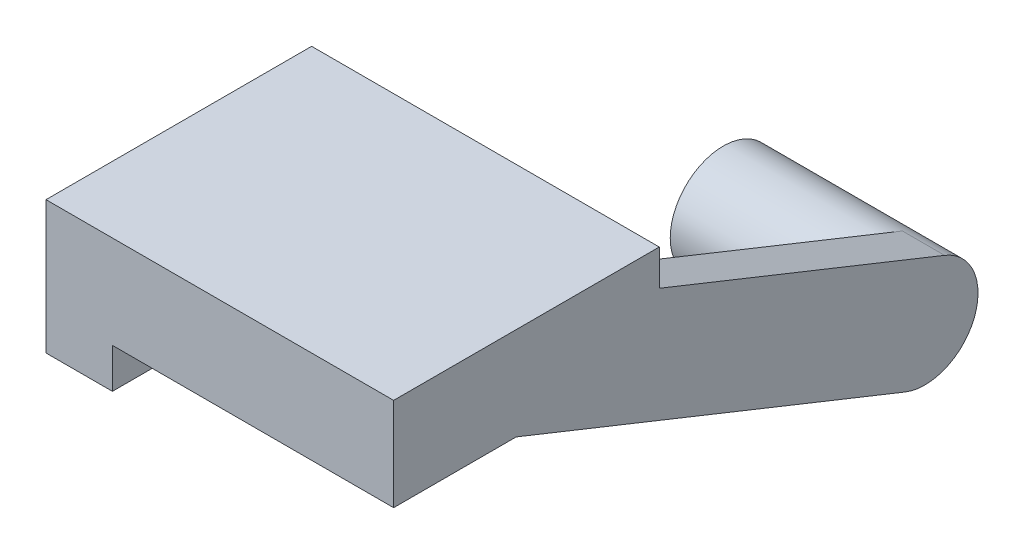
from build123d import *

# Parameters (mm, degrees)
SKETCH1_W           = 20
SKETCH1_H           = 10
SKETCH1_R           = 1.65
BOSS_EXTRUDE1_DEPTH = 5
SKETCH2_W           = 20
SKETCH2_H           = 7
BOSS_EXTRUDE2_DEPTH = 18
BOSS_EXTRUDE3_DEPTH = 3.175
BOSS_EXTRUDE4_START = 12
SKETCH4_R           = 4
BOSS_EXTRUDE4_DEPTH = 12


with BuildPart() as part:
    # Sketch1 → Boss-Extrude1 (new body)
    with BuildSketch(Plane(origin=(0, 0, 0), x_dir=(0, 0, -1), z_dir=(1, 0, 0))):
        Rectangle(SKETCH1_W, SKETCH1_H)
        with Locations((-5, 0)):
            Circle(SKETCH1_R, mode=Mode.SUBTRACT)
        with Locations((5, 0)):
            Circle(SKETCH1_R, mode=Mode.SUBTRACT)
    extrude(amount=BOSS_EXTRUDE1_DEPTH)

    # Sketch2 → Boss-Extrude2 (add)
    with BuildSketch(Plane(origin=(5, 0, 0), x_dir=(0, 0, -1), z_dir=(1, 0, 0))):
        with Locations((0, 1.5)):
            Rectangle(SKETCH2_W, SKETCH2_H)
    extrude(amount=BOSS_EXTRUDE2_DEPTH)

    # Sketch3 → Boss-Extrude3 (add)
    with BuildSketch(Plane(origin=(23, 0, 0), x_dir=(0, 0, -1), z_dir=(1, 0, 0))):
        with BuildLine():
            Line((10, 5), (-10, 5))
            Line((-10, 5), (-10, -2))
            Line((-10, -2), (-0.770329614, -2))
            Line((-0.770329614, -2), (6, -2))
            ThreePointArc((6, -2), (7.171572875, 0.828427125), (10, 2))
            Line((10, 2), (10, 2.308131846))
            Line((10, 2.308131846), (10, 5))
        make_face()
        with BuildLine():
            Line((10, -2), (10, 2))
            ThreePointArc((10, 2), (7.171572875, 0.828427125), (6, -2))
            Line((6, -2), (10, -2))
        make_face()
        with BuildLine():
            ThreePointArc((11.485562705, 1.713906764), (10.756430085, 1.927825547), (10, 2))
            Line((10, 2), (10, -2))
            Line((10, -2), (6, -2))
            ThreePointArc((6, -2), (6.687731078, -4.242515237), (8.514437295, -5.713906764))
            Line((8.514437295, -5.713906764), (28.514437295, -13.713906764))
            ThreePointArc((28.514437295, -13.713906764), (33.713906764, -11.485562705), (31.485562705, -6.286093236))
            Line((31.485562705, -6.286093236), (11.485562705, 1.713906764))
        make_face()
        with BuildLine():
            Line((6, -2), (-0.770329614, -2))
            Line((-0.770329614, -2), (8.514437295, -5.713906764))
            ThreePointArc((8.514437295, -5.713906764), (6.687731078, -4.242515237), (6, -2))
        make_face()
        with BuildLine():
            Line((11.485562705, 1.713906764), (10, 2.308131846))
            Line((10, 2.308131846), (10, 2))
            ThreePointArc((10, 2), (10.756430085, 1.927825547), (11.485562705, 1.713906764))
        make_face()
    extrude(amount=BOSS_EXTRUDE3_DEPTH)

    # Sketch4 → Boss-Extrude4 (add)
    with BuildSketch(Plane.ZY.offset(-23).offset(BOSS_EXTRUDE4_START)):
        with Locations((-30, -10)):
            Circle(SKETCH4_R)
    extrude(amount=-BOSS_EXTRUDE4_DEPTH)


solid = part.part
